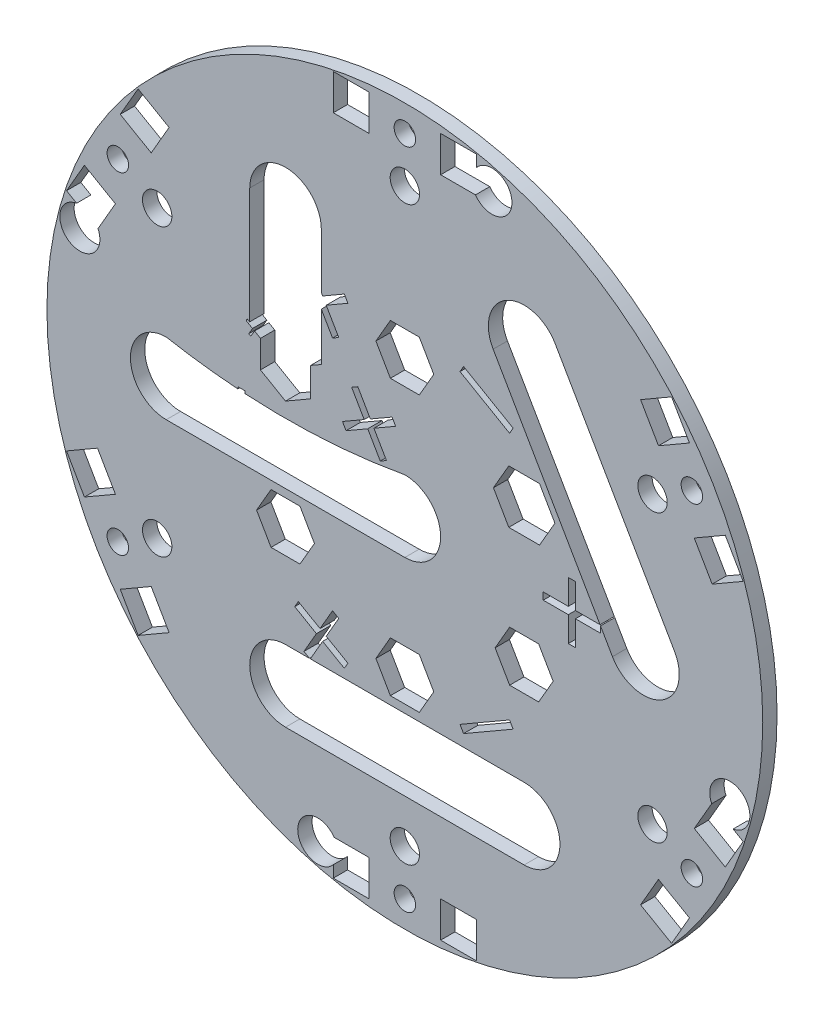
from build123d import *

# Parameters (mm, degrees)
ESQUISSE1_R        = 50
ESQUISSE1_W        = 5
ESQUISSE1_H        = 5
ESQUISSE1_R_2      = 1.5
ESQUISSE1_R_3      = 2.05
BOSS_EXTRU_1_DEPTH = 2
SKETCH3_W          = 1
SKETCH3_H          = 8
CUT_EXTRUDE2_DEPTH = 10
SKETCH4_R          = 2.8
CUT_EXTRUDE4_DEPTH = 10


with BuildPart() as part:
    # Esquisse1 → Boss.-Extru.1 (new body)
    with BuildSketch(Plane.XY):
        Circle(ESQUISSE1_R)
        Polygon((-39.762039705, -28.730127019), (-35.431912686, -26.230127019), (-32.931912686, -30.560254038), (-37.262039705, -33.060254038), align=None, mode=Mode.SUBTRACT)
        with Locations((-7.5, -46.3)):
            Rectangle(ESQUISSE1_W, ESQUISSE1_H, mode=Mode.SUBTRACT)
        with BuildLine():
            ThreePointArc((16.666666667, -23.867513459), (21.666666667, -28.867513459), (16.666666667, -33.867513459))
            Line((16.666666667, -33.867513459), (-16.666666667, -33.867513459))
            ThreePointArc((-16.666666667, -33.867513459), (-21.666666667, -28.867513459), (-16.666666667, -23.867513459))
            Line((-16.666666667, -23.867513459), (16.666666667, -23.867513459))
        make_face(mode=Mode.SUBTRACT)
        with Locations((-40.096976195, -23.15)):
            Circle(ESQUISSE1_R_2, mode=Mode.SUBTRACT)
        Polygon((-42.931912686, -13.239745962), (-40.431912686, -17.569872981), (-44.762039705, -20.069872981), (-47.262039705, -15.739745962), align=None, mode=Mode.SUBTRACT)
        with Locations((-34.597845014, -19.975075133)):
            Circle(ESQUISSE1_R_3, mode=Mode.SUBTRACT)
        Polygon((-14.65067109, -6.125235564), (-12.629945148, -9.625235564), (-14.65067109, -13.125235564), (-18.692122975, -13.125235564), (-20.712848917, -9.625235564), (-18.692122975, -6.125235564), align=None, mode=Mode.SUBTRACT)
        with Locations((0, -46.3)):
            Circle(ESQUISSE1_R_2, mode=Mode.SUBTRACT)
        with Locations((7.5, -46.3)):
            Rectangle(ESQUISSE1_W, ESQUISSE1_H, mode=Mode.SUBTRACT)
        with Locations((0, -39.950150265)):
            Circle(ESQUISSE1_R_3, mode=Mode.SUBTRACT)
        Polygon((32.931912686, -30.560254038), (35.431912686, -26.230127019), (39.762039705, -28.730127019), (37.262039705, -33.060254038), align=None, mode=Mode.SUBTRACT)
        Polygon((-2.020725942, -15.732757636), (2.020725942, -15.732757636), (4.041451884, -19.232757636), (2.020725942, -22.732757636), (-2.020725942, -22.732757636), (-4.041451884, -19.232757636), align=None, mode=Mode.SUBTRACT)
        Polygon((12.613362458, -9.622504487), (14.640014562, -6.112240073), (18.693318771, -6.112240073), (20.719970875, -9.622504487), (18.693318771, -13.132768901), (14.640014562, -13.132768901), align=None, mode=Mode.SUBTRACT)
        with Locations((34.597845014, -19.975075132)):
            Circle(ESQUISSE1_R_3, mode=Mode.SUBTRACT)
        with Locations((40.096976195, -23.15)):
            Circle(ESQUISSE1_R_2, mode=Mode.SUBTRACT)
        Polygon((44.762039705, -20.069872981), (40.431912686, -17.569872981), (42.931912686, -13.239745962), (47.262039705, -15.739745962), align=None, mode=Mode.SUBTRACT)
        Polygon((-44.762039705, 20.069872981), (-40.431912686, 17.569872981), (-42.931912686, 13.239745962), (-47.262039705, 15.739745962), align=None, mode=Mode.SUBTRACT)
        with Locations((-40.096976195, 23.15)):
            Circle(ESQUISSE1_R_2, mode=Mode.SUBTRACT)
        with Locations((-34.597845014, 19.975075133)):
            Circle(ESQUISSE1_R_3, mode=Mode.SUBTRACT)
        with BuildLine():
            Line((0, -5), (-33.333333333, -5))
            ThreePointArc((-33.333333333, -5), (-38.333333333, 0), (-33.333333333, 5))
            ThreePointArc((-33.333333333, 5), (-16.666666667, 3.481507562), (0, 5))
            ThreePointArc((0, 5), (5, 0), (0, -5))
        make_face(mode=Mode.SUBTRACT)
        with BuildLine():
            Line((-20.170900168, 11.646821857), (-21.670687629, 12.511577336))
            Line((-21.670687629, 12.511577336), (-21.666666516, 28.868742619))
            ThreePointArc((-21.666666516, 28.868742619), (-16.665437507, 33.867513308), (-11.666666818, 28.8662843))
            Line((-11.666666818, 28.8662843), (-11.670687326, 12.511578324))
            Line((-11.670687326, 12.511578324), (-13.170900379, 11.645101034))
            Line((-13.170900379, 11.645101034), (-13.171893897, 7.603649272))
            Line((-13.171893897, 7.603649272), (-16.67239055, 5.583783802))
            Line((-16.67239055, 5.583783802), (-20.171893686, 7.605370095))
            Line((-20.171893686, 7.605370095), (-20.170900168, 11.646821857))
        make_face(mode=Mode.SUBTRACT)
        Polygon((-32.931912686, 30.560254038), (-35.431912686, 26.230127019), (-39.762039705, 28.730127019), (-37.262039705, 33.060254038), align=None, mode=Mode.SUBTRACT)
        with Locations((0, 39.950150265)):
            Circle(ESQUISSE1_R_3, mode=Mode.SUBTRACT)
        with Locations((-7.5, 46.3)):
            Rectangle(ESQUISSE1_W, ESQUISSE1_H, mode=Mode.SUBTRACT)
        Polygon((18.816438469, 13.342663918), (20.963305142, 9.624181764), (18.816438469, 5.905699609), (14.522705123, 5.905699609), (12.37583845, 9.624181764), (14.522705123, 13.342663918), align=None, mode=Mode.SUBTRACT)
        Polygon((2.020725942, 22.665334425), (4.041451884, 19.165334425), (2.020725942, 15.665334425), (-2.020725942, 15.665334425), (-4.041451884, 19.165334425), (-2.020725942, 22.665334425), align=None, mode=Mode.SUBTRACT)
        with BuildLine():
            ThreePointArc((12.336539648, 26.367513459), (14.166666667, 33.197640478), (20.996793686, 31.367513459))
            Line((20.996793686, 31.367513459), (37.663460352, 2.5))
            ThreePointArc((37.663460352, 2.5), (35.833333333, -4.330127019), (29.003206314, -2.5))
            Line((29.003206314, -2.5), (12.336539648, 26.367513459))
        make_face(mode=Mode.SUBTRACT)
        with Locations((34.597845014, 19.975075133)):
            Circle(ESQUISSE1_R_3, mode=Mode.SUBTRACT)
        Polygon((42.931912686, 13.239745962), (40.431912686, 17.569872981), (44.762039705, 20.069872981), (47.262039705, 15.739745962), align=None, mode=Mode.SUBTRACT)
        with Locations((40.096976195, 23.15)):
            Circle(ESQUISSE1_R_2, mode=Mode.SUBTRACT)
        with Locations((0, 46.3)):
            Circle(ESQUISSE1_R_2, mode=Mode.SUBTRACT)
        with Locations((7.5, 46.3)):
            Rectangle(ESQUISSE1_W, ESQUISSE1_H, mode=Mode.SUBTRACT)
        Polygon((39.762039705, 28.730127019), (35.431912686, 26.230127019), (32.931912686, 30.560254038), (37.262039705, 33.060254038), align=None, mode=Mode.SUBTRACT)
    extrude(amount=BOSS_EXTRU_1_DEPTH)

    # Sketch3 → Cut-Extrude2 (cut)
    with BuildSketch(Plane.XY.offset(2)):
        with Locations((-22.833333333, 0)):
            Rectangle(SKETCH3_W, SKETCH3_H)
        Polygon((-13.233653965, 23.921361037), (-14.099679369, 23.421361037), (-12.349679369, 20.390272124), (-15.380768282, 18.640272124), (-14.880768282, 17.77424672), (-11.849679369, 19.52424672), (-10.099679369, 16.493157806), (-9.233653965, 16.993157806), (-10.983653965, 20.02424672), (-7.952565052, 21.77424672), (-8.452565052, 22.640272124), (-11.483653965, 20.890272124), align=None)
        Polygon((15.130768282, 18.207259422), (14.630768282, 17.341234018), (7.702565052, 21.341234018), (8.202565052, 22.207259422), align=None)
        Polygon((8.202565052, -22.207259422), (7.702565052, -21.341234018), (14.630768282, -17.341234018), (15.130768282, -18.207259422), align=None)
        Polygon((27.333333333, -0.5), (27.333333333, 0.5), (23.833333333, 0.5), (23.833333333, 4), (22.833333333, 4), (22.833333333, 0.5), (19.333333333, 0.5), (19.333333333, -0.5), (22.833333333, -0.5), (22.833333333, -4), (23.833333333, -4), (23.833333333, -0.5), align=None)
        Polygon((-14.099679369, -23.421361037), (-13.233653965, -23.921361037), (-11.483653965, -20.890272124), (-8.452565052, -22.640272124), (-7.952565052, -21.77424672), (-10.983653965, -20.02424672), (-9.233653965, -16.993157806), (-10.099679369, -16.493157806), (-11.849679369, -19.52424672), (-14.880768282, -17.77424672), (-15.380768282, -18.640272124), (-12.349679369, -20.390272124), align=None)
        Polygon((-7.433012703, 11.874355655), (-5.683012702, 8.843266741), (-8.714101616, 7.093266741), (-8.214101616, 6.227241337), (-5.183012702, 7.977241336), (-3.433012703, 4.946152425), (-2.566987299, 5.446152425), (-4.316987299, 8.477241337), (-1.285898385, 10.227241337), (-1.785898385, 11.093266741), (-4.816987299, 9.343266741), (-6.566987299, 12.374355655), align=None)
        Polygon((-20.834234776, 12.184801987), (-19.940304487, 11.668776346), (-20.102964744, 11.386925384), (-20.996895032, 11.902951025), (-21.517828526, 11.000607275), (-21.800380609, 11.163968654), (-21.279447115, 12.066312404), (-22.173377404, 12.582338045), (-22.010717147, 12.864189006), (-21.116786859, 12.348163365), (-20.596554487, 13.24840375), (-20.314002404, 13.085042371), align=None)
    extrude(amount=-CUT_EXTRUDE2_DEPTH, mode=Mode.SUBTRACT)

    # Sketch4 → Cut-Extrude4 (cut)
    with BuildSketch(Plane.XY.offset(2)):
        with Locations((-12.16449512, -45.398513836)):
            Circle(SKETCH4_R)
        with Locations((-45.398513836, 12.16449512)):
            Circle(SKETCH4_R)
        with Locations((12.16449512, 45.398513836)):
            Circle(SKETCH4_R)
        with Locations((45.398513836, -12.16449512)):
            Circle(SKETCH4_R)
    extrude(amount=-CUT_EXTRUDE4_DEPTH, mode=Mode.SUBTRACT)


solid = part.part
